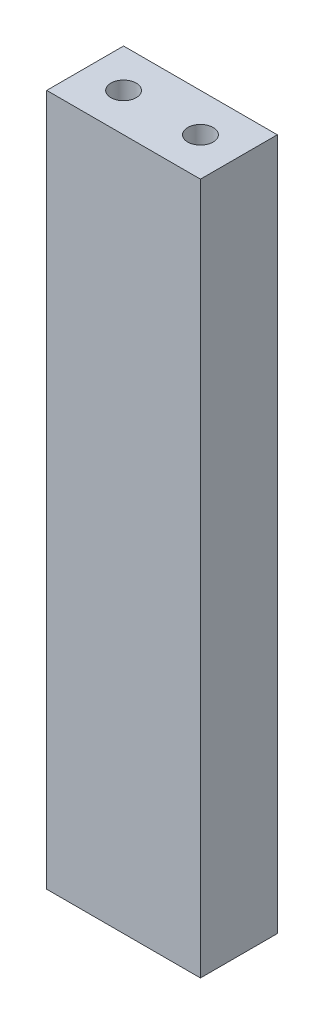
from build123d import *

# Parameters (mm, degrees)
SKETCH1_W                 = 20
SKETCH1_H                 = 10
BOSS_EXTRUDE1_DEPTH       = 90
M4X0_7_TAPPED_HOLE1_D     = 3.3
M4X0_7_TAPPED_HOLE1_DEPTH = 15
M4X0_7_TAPPED_HOLE1_TIP   = 0.991420021
M4X0_7_TAPPED_HOLE2_D     = 3.3
M4X0_7_TAPPED_HOLE2_DEPTH = 15
M4X0_7_TAPPED_HOLE2_TIP   = 0.991420021


with BuildPart() as part:
    # Sketch1 → Boss-Extrude1 (new body)
    with BuildSketch(Plane(origin=(0, 0, 0), x_dir=(1, 0, 0), z_dir=(0, 1, 0))):
        Rectangle(SKETCH1_W, SKETCH1_H)
    extrude(amount=BOSS_EXTRUDE1_DEPTH)

    # M4x0.7 Tapped Hole1
    with Locations(Plane(origin=(0, 0, 0), x_dir=(-1, 0, 0), z_dir=(0, -1, 0))):
        with Locations((-5, 0), (5, 0)):
            Hole(M4X0_7_TAPPED_HOLE1_D / 2, depth=M4X0_7_TAPPED_HOLE1_DEPTH)
            with Locations((0, 0, -(M4X0_7_TAPPED_HOLE1_DEPTH + M4X0_7_TAPPED_HOLE1_TIP / 2))):  # 118° drill point
                Cone(0, M4X0_7_TAPPED_HOLE1_D / 2, M4X0_7_TAPPED_HOLE1_TIP, mode=Mode.SUBTRACT)

    # M4x0.7 Tapped Hole2
    with Locations(Plane(origin=(0, 90, 0), x_dir=(1, 0, 0), z_dir=(0, 1, 0))):
        with Locations((-5, 0), (5, 0)):
            Hole(M4X0_7_TAPPED_HOLE2_D / 2, depth=M4X0_7_TAPPED_HOLE2_DEPTH)
            with Locations((0, 0, -(M4X0_7_TAPPED_HOLE2_DEPTH + M4X0_7_TAPPED_HOLE2_TIP / 2))):  # 118° drill point
                Cone(0, M4X0_7_TAPPED_HOLE2_D / 2, M4X0_7_TAPPED_HOLE2_TIP, mode=Mode.SUBTRACT)


solid = part.part
